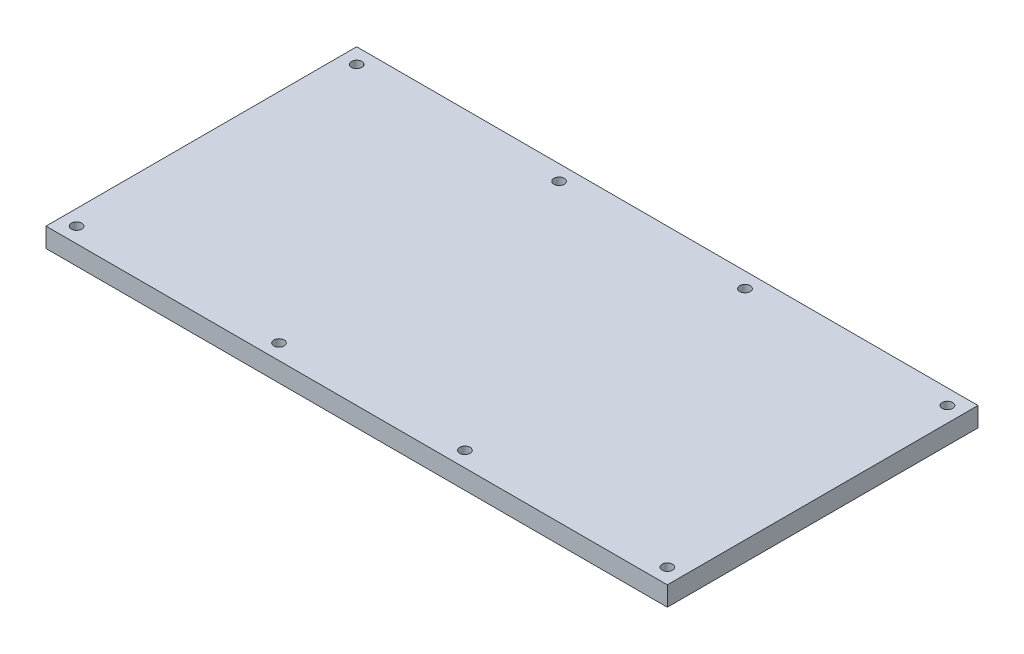
from build123d import *

# Parameters (mm, degrees)
SKETCH1_W           = 76.2
SKETCH1_H           = 101.6
BOSS_EXTRUDE1_DEPTH = 6.35
SKETCH2_R           = 1.7
CUT_EXTRUDE1_DEPTH  = 128.158650905
SKETCH3_W           = 101.6
SKETCH3_H           = 6.35
BOSS_EXTRUDE2_DEPTH = 50.8


with BuildPart() as part:
    # Sketch1 → Boss-Extrude1 (new body)
    with BuildSketch(Plane(origin=(0, 0, 0), x_dir=(1, 0, 0), z_dir=(0, 1, 0))):
        with Locations((38.1, 50.8)):
            Rectangle(SKETCH1_W, SKETCH1_H)
    extrude(amount=BOSS_EXTRUDE1_DEPTH)

    # Sketch2 → Cut-Extrude1 (cut, through all)
    with BuildSketch(Plane(origin=(0, 6.35, 0), x_dir=(1, 0, 0), z_dir=(0, 1, 0))):
        with Locations(Location((5, 96.6, 0), (0, 0, 270))):
            Circle(SKETCH2_R)
        with Locations(Location((71.2, 96.6, 0), (0, 0, 90))):
            Circle(SKETCH2_R)
        with Locations(Location((71.2, 5, 0), (0, 0, 270))):
            Circle(SKETCH2_R)
        with Locations(Location((5, 5, 0), (0, 0, 90))):
            Circle(SKETCH2_R)
    extrude(amount=-CUT_EXTRUDE1_DEPTH, mode=Mode.SUBTRACT)


with BuildPart() as body_2:
    # Mirror2: mirrored copy
    add(part.part.mirror(Plane.ZY.offset(25.4)))


with BuildPart() as part_1:
    add(part.part)

    add(body_2.part)  # Boss-Extrude2 merges body 2
    # Sketch3 → Boss-Extrude2 (add)
    with BuildSketch(Plane(origin=(-50.8, 0, 0), x_dir=(0, 0, -1), z_dir=(1, 0, 0))):
        with Locations((50.8, 3.175)):
            Rectangle(SKETCH3_W, SKETCH3_H)
    extrude(amount=BOSS_EXTRUDE2_DEPTH)


solid = part_1.part
